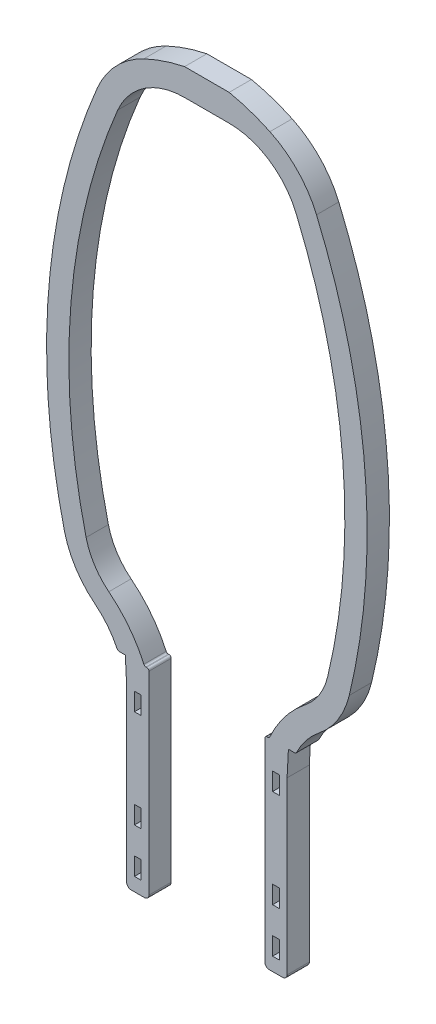
from build123d import *
from OCP.BRepFilletAPI import BRepFilletAPI_MakeChamfer

# Parameters (mm, degrees)
SKETCH1_W           = 1.5
SKETCH1_H           = 4
BOSS_EXTRUDE2_DEPTH = 5
FILLET1_R           = 0.5
CHAMFER1_SIZE       = 0.3
CHAMFER1_SIZE2      = 5.724341006
FILLET2_R           = 1


with BuildPart() as part:
    # Sketch1 → Boss-Extrude2 (new body)
    with BuildSketch(Plane.XY):
        with BuildLine():
            Line((-18, 0), (-18, -45))
            Line((-18, -45), (-13, -45))
            Line((-13, -45), (-13, 0))
            Line((-13, 0), (-14, 0))
            ThreePointArc((-14, 0), (-17.356723571, 5.717389506), (-22, 10.449843403))
            ThreePointArc((-22, 10.449843403), (-25.217580201, 14.024096355), (-27.099300045, 18.449843403))
            ThreePointArc((-27.099300045, 18.449843403), (-30.501361107, 62.323372475), (-20, 105.057223081))
            ThreePointArc((-20, 105.057223081), (-16.767609995, 109.972410851), (-12, 113.418758324))
            ThreePointArc((-12, 113.418758324), (-8.588186354, 114.5997714), (-5, 115))
            Line((-5, 115), (0, 115))
            Line((0, 115), (5, 115))
            ThreePointArc((5, 115), (8.588186354, 114.5997714), (12, 113.418758324))
            ThreePointArc((12, 113.418758324), (16.767609995, 109.972410851), (20, 105.057223081))
            ThreePointArc((20, 105.057223081), (30.501361107, 62.323372475), (27.099300045, 18.449843403))
            ThreePointArc((27.099300045, 18.449843403), (25.217580201, 14.024096355), (22, 10.449843403))
            ThreePointArc((22, 10.449843403), (17.356723571, 5.717389506), (14, 0))
            Line((14, 0), (13, 0))
            Line((13, 0), (13, -45))
            Line((13, -45), (18, -45))
            Line((18, -45), (18, 0))
            Line((18, 0), (20, 0))
            ThreePointArc((20, 0), (22.171979479, 3.570426989), (25.114361701, 6.538225938))
            ThreePointArc((25.114361701, 6.538225938), (29.4338834, 11.336571968), (31.960045669, 17.278027726))
            ThreePointArc((31.960045669, 17.278027726), (35.484647146, 62.731857791), (24.605032643, 107.004958781))
            ThreePointArc((24.605032643, 107.004958781), (20.380385499, 113.428977522), (14.149246958, 117.933261343))
            ThreePointArc((14.149246958, 117.933261343), (9.667432642, 119.743515679), (5, 121))
            Line((5, 121), (-5, 121))
            ThreePointArc((-5, 121), (-9.667432642, 119.743515679), (-14.149246958, 117.933261343))
            ThreePointArc((-14.149246958, 117.933261343), (-20.380385499, 113.428977522), (-24.605032643, 107.004958781))
            ThreePointArc((-24.605032643, 107.004958781), (-35.484647146, 62.731857791), (-31.960045669, 17.278027726))
            ThreePointArc((-31.960045669, 17.278027726), (-29.4338834, 11.336571968), (-25.114361701, 6.538225938))
            ThreePointArc((-25.114361701, 6.538225938), (-22.171979479, 3.570426989), (-20, 0))
            Line((-20, 0), (-18, 0))
        make_face()
        with Locations((15.5, -8)):
            Rectangle(SKETCH1_W, SKETCH1_H, mode=Mode.SUBTRACT)
        with Locations((-15.5, -40)):
            Rectangle(SKETCH1_W, SKETCH1_H, mode=Mode.SUBTRACT)
        with Locations((15.5, -40)):
            Rectangle(SKETCH1_W, SKETCH1_H, mode=Mode.SUBTRACT)
        with Locations((-15.5, -8)):
            Rectangle(SKETCH1_W, SKETCH1_H, mode=Mode.SUBTRACT)
        with Locations((-15.5, -30)):
            Rectangle(SKETCH1_W, SKETCH1_H, mode=Mode.SUBTRACT)
        with Locations((15.5, -30)):
            Rectangle(SKETCH1_W, SKETCH1_H, mode=Mode.SUBTRACT)
    extrude(amount=BOSS_EXTRUDE2_DEPTH)

    # Fillet1
    fillet1_edges = [part.edges().sort_by_distance(p)[0] for p in [
        (-20, 0, 2.5),
        (20, 0, 2.5),
        (13, 0, 2.5),
        (14, 0, 2.5),
        (-14, 0, 2.5),
        (-13, 0, 2.5),
    ]]
    fillet(fillet1_edges, radius=FILLET1_R)

    # Chamfer1: one chamfer whose edges measure the first distance from different faces: ONE call of the kernel's chamfer builder (chamfer() names one face for all edges)
    chamfer1_edges_1 = [part.edges().sort_by_distance(p)[0] for p in [
        (-18, 0, 2.5),
    ]]
    chamfer1_side_1 = [part.faces().sort_by_distance(p)[0] for p in [
        (-18.841037528, 0, 2.5),
    ]]
    chamfer1_edges_2 = [part.edges().sort_by_distance(p)[0] for p in [
        (18, 0, 2.5),
    ]]
    chamfer1_side_2 = [part.faces().sort_by_distance(p)[0] for p in [
        (18.841037528, 0, 2.5),
    ]]
    chamfer1 = BRepFilletAPI_MakeChamfer(part.part.solid().wrapped)
    for e in chamfer1_edges_1:
        chamfer1.Add(CHAMFER1_SIZE, CHAMFER1_SIZE2, e.wrapped, chamfer1_side_1[0].wrapped)  # the first distance lies on this face
    for e in chamfer1_edges_2:
        chamfer1.Add(CHAMFER1_SIZE, CHAMFER1_SIZE2, e.wrapped, chamfer1_side_2[0].wrapped)  # the first distance lies on this face
    add(Compound.cast(chamfer1.Shape()), mode=Mode.REPLACE)

    # Fillet2
    fillet2_edges = [part.edges().sort_by_distance(p)[0] for p in [
        (-13, -45, 2.5),
        (-18, -45, 2.5),
        (18, -45, 2.5),
        (13, -45, 2.5),
    ]]
    fillet(fillet2_edges, radius=FILLET2_R)


solid = part.part
